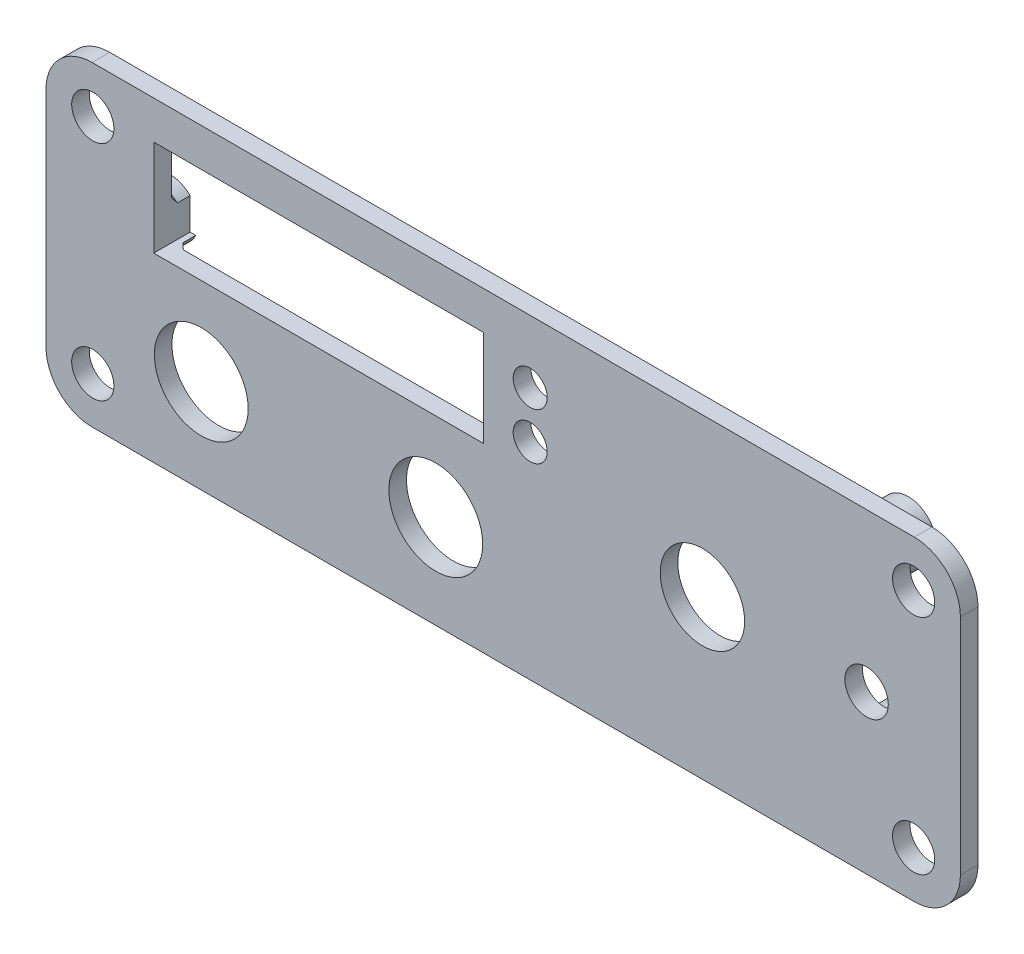
from build123d import *

# Parameters (mm, degrees)
SKETCH2_R           = 1.8
SKETCH2_R_2         = 3.6
SKETCH2_R_3         = 4
SKETCH2_R_4         = 1.45
SKETCH2_R_5         = 1.85
SKETCH2_W           = 28.1
SKETCH2_H           = 8.2
BOSS_EXTRUDE2_DEPTH = 1.5
SKETCH3_R           = 2.4
SKETCH3_R_2         = 0.9
BOSS_EXTRUDE3_DEPTH = 1.6
SKETCH4_R           = 2.4
SKETCH4_R_2         = 0.9
BOSS_EXTRUDE4_DEPTH = 4.8
CHAMFER1_SIZE       = 0.5


with BuildPart() as part:
    # Sketch2 → Boss-Extrude2 (new body)
    with BuildSketch(Plane.XY):
        with BuildLine():
            Line((0, 22.989), (0, 3.935))
            ThreePointArc((0, 3.935), (1.152534816, 1.152534816), (3.935, 0))
            Line((3.935, 0), (74.043, 0))
            ThreePointArc((74.043, 0), (76.825465184, 1.152534816), (77.978, 3.935))
            Line((77.978, 3.935), (77.978, 22.989))
            ThreePointArc((77.978, 22.989), (76.825465184, 25.771465184), (74.043, 26.924))
            Line((74.043, 26.924), (3.935, 26.924))
            ThreePointArc((3.935, 26.924), (1.152534816, 25.771465184), (0, 22.989))
        make_face()
        with Locations((3.989, 22.962)):
            Circle(SKETCH2_R, mode=Mode.SUBTRACT)
        with Locations((73.989, 22.962)):
            Circle(SKETCH2_R, mode=Mode.SUBTRACT)
        with Locations((3.989, 3.962)):
            Circle(SKETCH2_R, mode=Mode.SUBTRACT)
        with Locations((73.989, 3.962)):
            Circle(SKETCH2_R, mode=Mode.SUBTRACT)
        with Locations((55.978, 13.462)):
            Circle(SKETCH2_R_2, mode=Mode.SUBTRACT)
        with Locations((13.239, 8)):
            Circle(SKETCH2_R_3, mode=Mode.SUBTRACT)
        with Locations((33.239, 8)):
            Circle(SKETCH2_R_3, mode=Mode.SUBTRACT)
        with Locations((41.289, 21.574)):
            Circle(SKETCH2_R_4, mode=Mode.SUBTRACT)
        with Locations((41.289, 17.574)):
            Circle(SKETCH2_R_4, mode=Mode.SUBTRACT)
        with Locations((69.978, 13.462)):
            Circle(SKETCH2_R_5, mode=Mode.SUBTRACT)
        with Locations((23.239, 19.574)):
            Rectangle(SKETCH2_W, SKETCH2_H, mode=Mode.SUBTRACT)
    extrude(amount=BOSS_EXTRUDE2_DEPTH)

    # Sketch3 → Boss-Extrude3 (add)
    # profile 1 of 2: a face of its own
    with BuildSketch(Plane(origin=(0, 0, 0), x_dir=(-1, 0, 0), z_dir=(0, 0, -1))):
        with Locations(Location((-46.239, 22.674, 0), (0, 0, 180))):
            Circle(SKETCH3_R)
        with Locations((-46.239, 22.674)):
            Circle(SKETCH3_R_2, mode=Mode.SUBTRACT)
    # profile 2 of 2: a face of its own
    with BuildSketch(Plane(origin=(0, 0, 0), x_dir=(-1, 0, 0), z_dir=(0, 0, -1))):
        with BuildLine():
            Line((-9.189, 15.474), (-9.670742423, 15.474))
            ThreePointArc((-9.670742423, 15.474), (-5.126472799, 16.051548555), (-9.189, 18.168107435))
            Line((-9.189, 18.168107435), (-9.189, 15.474))
        make_face()
        with Locations((-7.489, 16.474)):
            Circle(SKETCH3_R_2, mode=Mode.SUBTRACT)
    extrude(amount=BOSS_EXTRUDE3_DEPTH)

    # Sketch4 → Boss-Extrude4 (add)
    # profile 1 of 3: a face of its own
    with BuildSketch(Plane(origin=(0, 0, 0), x_dir=(-1, 0, 0), z_dir=(0, 0, -1))):
        with Locations(Location((-67.228, 20.962, 0), (0, 0, 180))):
            Circle(SKETCH4_R)
        with Locations((-67.228, 20.962)):
            Circle(SKETCH4_R_2, mode=Mode.SUBTRACT)
    # profile 2 of 3: a face of its own
    with BuildSketch(Plane(origin=(0, 0, 0), x_dir=(-1, 0, 0), z_dir=(0, 0, -1))):
        with Locations(Location((-67.228, 5.962, 0), (0, 0, 180))):
            Circle(SKETCH4_R)
        with Locations((-67.228, 5.962)):
            Circle(SKETCH4_R_2, mode=Mode.SUBTRACT)
    # profile 3 of 3: a face of its own
    with BuildSketch(Plane(origin=(0, 0, 0), x_dir=(-1, 0, 0), z_dir=(0, 0, -1))):
        with Locations(Location((-45.728, 5.962, 0), (0, 0, 180))):
            Circle(SKETCH4_R)
        with Locations((-45.728, 5.962)):
            Circle(SKETCH4_R_2, mode=Mode.SUBTRACT)
    extrude(amount=BOSS_EXTRUDE4_DEPTH)

    # Chamfer1
    chamfer1_edges = [part.edges().sort_by_distance(p)[0] for p in [
        (5.126472799, 16.051548555, 0),
        (43.839, 22.674, 0),
        (64.828, 20.962, 0),
        (64.828, 5.962, 0),
        (43.328, 5.962, 0),
    ]]
    chamfer(chamfer1_edges, length=CHAMFER1_SIZE)


solid = part.part
